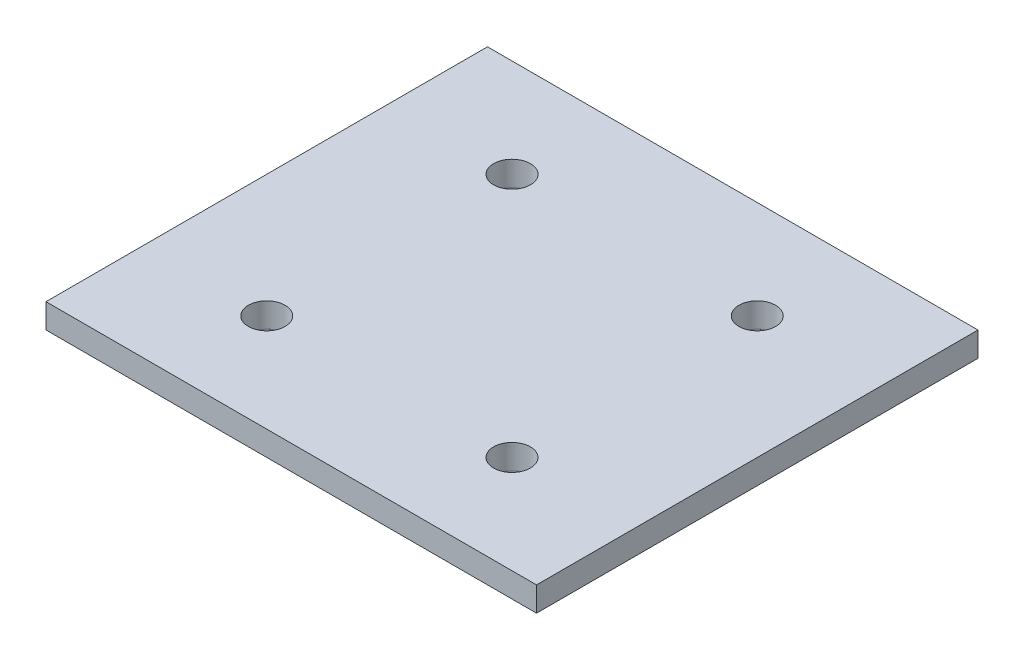
from build123d import *

# Parameters (mm, degrees)
SKETCH_1_W        = 40
SKETCH_1_H        = 36
SKETCH_1_R        = 1.5
EXTRUDE_1_DEPTH   = 2
SKETCH_2_R        = 3
SKETCH_2_R_2      = 1.5
EXTRUDE_2_DEPTH   = 5
EXTRUDE_2_2_DEPTH = 5
EXTRUDE_2_3_DEPTH = 5
EXTRUDE_2_4_DEPTH = 5


with BuildPart() as part:
    # 草图1 → 凸台-拉伸1 (new body)
    with BuildSketch(Plane(origin=(0, 0, 0), x_dir=(1, 0, 0), z_dir=(0, 1, 0))):
        Rectangle(SKETCH_1_W, SKETCH_1_H)
        with Locations(Location((-10, 10, 0), (0, 0, 270))):
            Circle(SKETCH_1_R, mode=Mode.SUBTRACT)
        with Locations(Location((10, 10, 0), (0, 0, 270))):
            Circle(SKETCH_1_R, mode=Mode.SUBTRACT)
        with Locations(Location((10, -10, 0), (0, 0, 270))):
            Circle(SKETCH_1_R, mode=Mode.SUBTRACT)
        with Locations(Location((-10, -10, 0), (0, 0, 270))):
            Circle(SKETCH_1_R, mode=Mode.SUBTRACT)
    extrude(amount=EXTRUDE_1_DEPTH)


with BuildPart() as body_2:
    # 草图2 → 凸台-拉伸2 (new body)
    with BuildSketch(Plane.XZ):
        with Locations(Location((-10, 10, 0), (0, 0, 270))):
            Circle(SKETCH_2_R)
        with Locations(Location((-10, 10, 0), (0, 0, 270))):
            Circle(SKETCH_2_R_2, mode=Mode.SUBTRACT)
    extrude(amount=EXTRUDE_2_DEPTH)


with BuildPart() as body_3:
    # 草图2 → Extrude 2 2 (new body)
    with BuildSketch(Plane.XZ):
        with Locations(Location((10, 10, 0), (0, 0, 90))):
            Circle(SKETCH_2_R)
        with Locations(Location((10, 10, 0), (0, 0, 90))):
            Circle(SKETCH_2_R_2, mode=Mode.SUBTRACT)
    extrude(amount=EXTRUDE_2_2_DEPTH)


with BuildPart() as body_4:
    # 草图2 → Extrude 2 3 (new body)
    with BuildSketch(Plane.XZ):
        with Locations(Location((10, -10, 0), (0, 0, 270))):
            Circle(SKETCH_2_R)
        with Locations(Location((10, -10, 0), (0, 0, 270))):
            Circle(SKETCH_2_R_2, mode=Mode.SUBTRACT)
    extrude(amount=EXTRUDE_2_3_DEPTH)


with BuildPart() as body_5:
    # 草图2 → Extrude 2 4 (new body)
    with BuildSketch(Plane.XZ):
        with Locations(Location((-10, -10, 0), (0, 0, 90))):
            Circle(SKETCH_2_R)
        with Locations(Location((-10, -10, 0), (0, 0, 90))):
            Circle(SKETCH_2_R_2, mode=Mode.SUBTRACT)
    extrude(amount=EXTRUDE_2_4_DEPTH)


solid = Compound([part.part, body_2.part, body_3.part, body_4.part, body_5.part])
